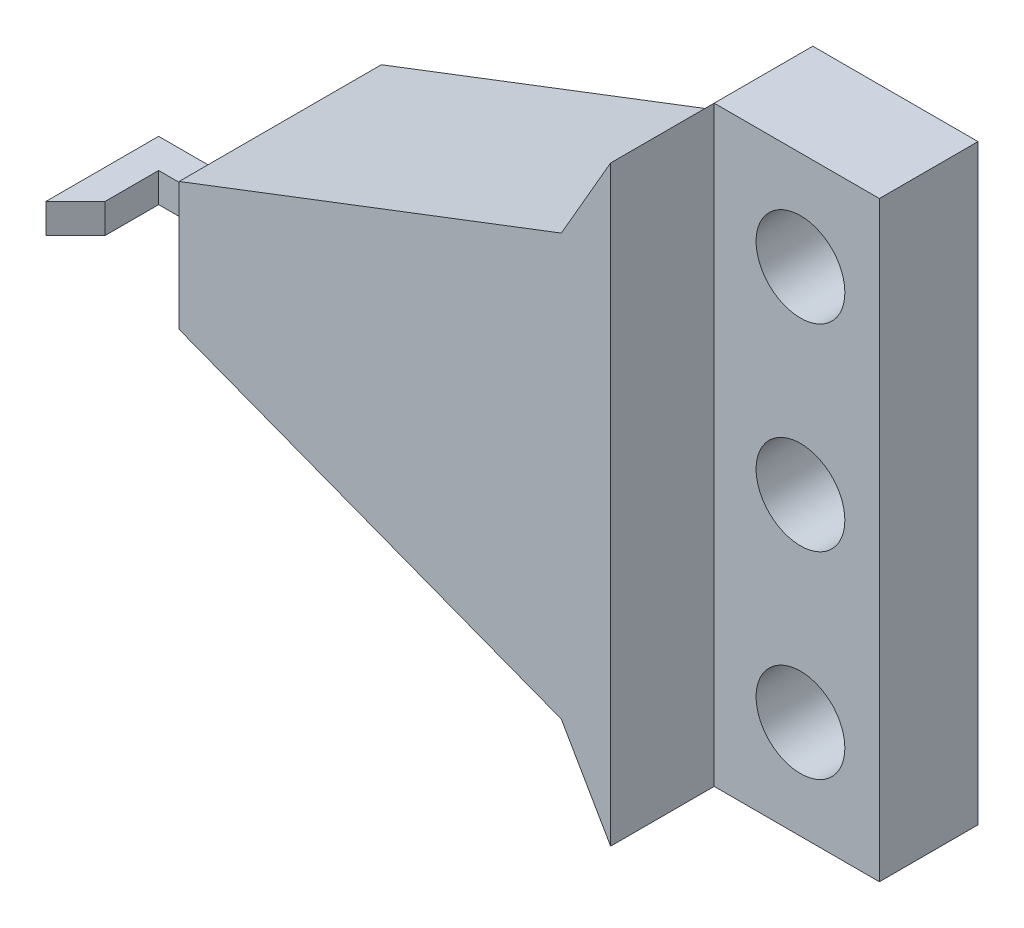
from build123d import *

# Parameters (mm, degrees)
SKETCH1_W                = 8.509
SKETCH1_H                = 30.48
SKETCH1_R                = 2.286
BOSS_EXTRUDE1_DEPTH      = 5.08
BOSS_EXTRUDE2_DEPTH      = 10.414
BOSS_EXTRUDE3_DEPTH      = 0.762
BOSS_EXTRUDE3_DEPTH_BACK = 0.762


with BuildPart() as part:
    # Sketch1 → Boss-Extrude1 (new body)
    with BuildSketch(Plane.XY):
        with Locations((-4.2545, -15.24)):
            Rectangle(SKETCH1_W, SKETCH1_H)
        with Locations((-4.064, -25.4)):
            Circle(SKETCH1_R, mode=Mode.SUBTRACT)
        with Locations((-4.064, -15.24)):
            Circle(SKETCH1_R, mode=Mode.SUBTRACT)
        with Locations((-4.064, -5.08)):
            Circle(SKETCH1_R, mode=Mode.SUBTRACT)
    extrude(amount=BOSS_EXTRUDE1_DEPTH)

    # Sketch1<3> → Boss-Extrude2 (add)
    with BuildSketch(Plane.XY):
        Polygon((-8.509, -30.48), (-8.509, 0), (-11.049, -4.399409051), (-30.734, -11.938), (-30.734, -15.015), (-30.734, -15.465), (-30.734, -18.542), (-11.049, -26.080590949), align=None)
    extrude(amount=BOSS_EXTRUDE2_DEPTH)

    # Sketch2 → Boss-Extrude3 (add, two sides: drawn at the far end of the back side and taken through both)
    with BuildSketch(Plane(origin=(0, -15.24, 0), x_dir=(-1, 0, 0), z_dir=(0, -1, 0)).offset(-BOSS_EXTRUDE3_DEPTH_BACK)):
        Polygon((35.814, -6.39), (30.734, -6.39), (30.734, -7.914), (34.29, -7.914), (34.29, -10.668), (35.814, -12.192), align=None)
    extrude(amount=BOSS_EXTRUDE3_DEPTH + BOSS_EXTRUDE3_DEPTH_BACK)


solid = part.part
